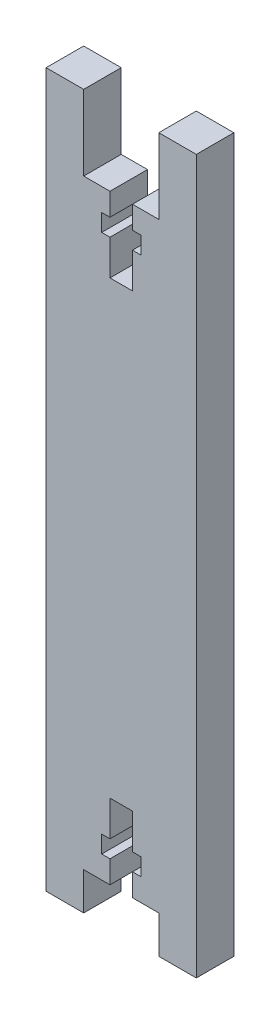
from build123d import *

# Parameters (mm, degrees)
BOSS_EXTRUDE1_DEPTH = 5


with BuildPart() as part:
    # Sketch1 → Boss-Extrude1 (new body)
    with BuildSketch(Plane.XY):
        Polygon((-1.5, 0), (-5, 0), (-5, -5), (-10, -5), (-10, 0), (-10, 80), (-10, 85), (-10, 90), (-5, 90), (-5, 85), (-5, 80), (-1.5, 80), (-1.5, 77), (-2.6, 77), (-2.6, 74.7), (-1.5, 74.7), (-1.5, 70), (1.5, 70), (1.5, 74.7), (2.6, 74.7), (2.6, 77), (1.5, 77), (1.5, 80), (5, 80), (5, 85), (5, 90), (10, 90), (10, 85), (10, 80), (10, 0), (10, -5), (5, -5), (5, 0), (1.5, 0), (1.5, 3), (2.6, 3), (2.6, 5.3), (1.5, 5.3), (1.5, 10), (-1.5, 10), (-1.5, 5.3), (-2.6, 5.3), (-2.6, 3), (-1.5, 3), align=None)
    extrude(amount=BOSS_EXTRUDE1_DEPTH)


solid = part.part
